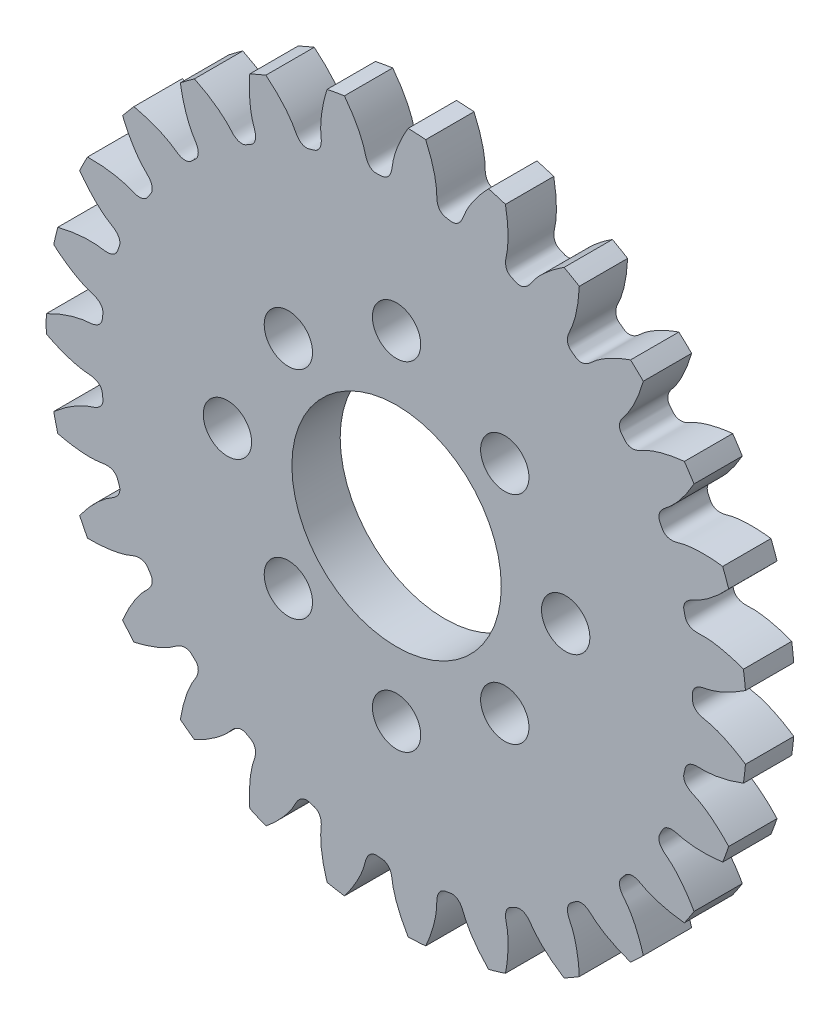
from build123d import *

# Parameters (mm, degrees)
SKETCH_327_W               = 3
SKETCH_327_H               = 21.749999673
CUT_EXTRUDE_553_DEPTH      = 9.525
PATTERN_CIRCULAR_607_COUNT = 27
SKETCH_665_W               = 19.05
SKETCH_665_H               = 6.5
CUT_EXTRUDE_1_REACH        = 32.897
SKETCH_1_R                 = 1.5


with BuildPart() as part:
    # Sketch 327 → Revolve 419 (revolve)
    with BuildSketch(Plane(origin=(0, 0, 0), x_dir=(0, 0, -1), z_dir=(1, 0, 0))):
        with Locations((0, 10.874999837)):
            Rectangle(SKETCH_327_W, SKETCH_327_H)
    revolve(axis=Axis((0, 0, 0), (0, 0, 1)))

    # Sketch 464 → Cut-Extrude 553 (cut, symmetric)
    with BuildSketch(Plane.XY):
        with BuildLine():
            ThreePointArc((21.730304777, 2.030877891), (21.824999672, 0), (21.730304777, -2.030877891))
            add(Edge.make_bspline(
                [(21.730304777, -2.030877891), (21.501886389, -1.873005257), (21.197658391, -1.679531845), (20.814976774, -1.466934394), (20.608511116, -1.359700931), (20.412627925, -1.264842331), (20.227848841, -1.181675328), (20.054665262, -1.109495914), (19.893537225, -1.047584724), (19.744895024, -0.995197179), (19.609131187, -0.951599907), (19.486623858, -0.915959224), (19.377660921, -0.887697712), (19.224611474, -0.851769328), (19.091590311, -0.832682231), (18.97946804, -0.803877533), (18.938504059, -0.792161259), (18.898408399, -0.779360789), (18.859103535, -0.765407113), (18.820505879, -0.750182868), (18.782524195, -0.733542825), (18.745062981, -0.715298046), (18.708027516, -0.695207369), (18.671333287, -0.672964742), (18.634921744, -0.648186295), (18.598785594, -0.620398387), (18.563007332, -0.589031349), (18.527814407, -0.553427143), (18.493651175, -0.512874653), (18.461259631, -0.46669073), (18.431743083, -0.414366261), (18.40657092, -0.355773095), (18.387445258, -0.291417774), (18.376745236, -0.226629052), (18.372209912, -0.128961814), (18.37704903, 0), (18.372209912, 0.128961814), (18.376745236, 0.226629052), (18.387445258, 0.291417774), (18.40657092, 0.355773095), (18.431743083, 0.414366261), (18.461259631, 0.46669073), (18.493651175, 0.512874653), (18.527814407, 0.553427143), (18.563007332, 0.589031349), (18.598785594, 0.620398387), (18.634921744, 0.648186295), (18.671333287, 0.672964742), (18.708027516, 0.695207369), (18.745062981, 0.715298046), (18.782524195, 0.733542825), (18.820505879, 0.750182868), (18.859103535, 0.765407113), (18.898408399, 0.779360789), (18.938504059, 0.792161259), (18.97946804, 0.803877533), (19.091590311, 0.832682231), (19.224611474, 0.851769328), (19.377660921, 0.887697712), (19.486623858, 0.915959224), (19.609131187, 0.951599907), (19.744895024, 0.995197179), (19.893537225, 1.047584724), (20.054665262, 1.109495914), (20.227848841, 1.181675328), (20.412627925, 1.264842331), (20.608511116, 1.359700931), (20.814976774, 1.466934394), (21.197658391, 1.679531845), (21.501886389, 1.873005257), (21.730304777, 2.030877891)],
                knots=[0, 0, 0, 0, 0.100325391, 0.13015387, 0.158174562, 0.184387468, 0.208792587, 0.231389919, 0.252179465, 0.271161225, 0.288335198, 0.303701384, 0.317259784, 0.329010398, 0.360500466, 0.365705153, 0.370832136, 0.375895619, 0.380912221, 0.385901428, 0.390886139, 0.395893275, 0.400954451, 0.406106652, 0.411392808, 0.416862069, 0.422569417, 0.428574065, 0.434935827, 0.441708513, 0.44892966, 0.456607008, 0.464704448, 0.473133083, 0.48026443, 0.5, 0.51973557, 0.526866917, 0.535295552, 0.543392992, 0.55107034, 0.558291487, 0.565064173, 0.571425935, 0.577430583, 0.583137931, 0.588607192, 0.593893348, 0.599045549, 0.604106725, 0.609113861, 0.614098572, 0.619087779, 0.624104381, 0.629167864, 0.634294847, 0.639499534, 0.670989602, 0.682740216, 0.696298616, 0.711664802, 0.728838775, 0.747820535, 0.768610081, 0.791207413, 0.815612532, 0.841825438, 0.86984613, 0.899674609, 1, 1, 1, 1], degree=3))
        make_face()
    cut_extrude_553 = extrude(amount=CUT_EXTRUDE_553_DEPTH, both=True, mode=Mode.SUBTRACT)

    # Pattern Circular 607: Cut-Extrude 553 ×27 about axis
    pattern_circular_607_axis = Axis((0, 0, 55), (0, 0, -1))
    for i in range(1, PATTERN_CIRCULAR_607_COUNT):
        add(cut_extrude_553.rotate(pattern_circular_607_axis, i * 360 / PATTERN_CIRCULAR_607_COUNT), mode=Mode.SUBTRACT)

    # Sketch 665 → Cut-Revolve 724 (revolve, cut)
    with BuildSketch(Plane(origin=(0, 0, 0), x_dir=(0, 0, -1), z_dir=(1, 0, 0))):
        with Locations((0, 3.25)):
            Rectangle(SKETCH_665_W, SKETCH_665_H)
    revolve(axis=Axis((0, 0, 0), (0, 0, -1)), mode=Mode.SUBTRACT)

    # 草图1 → 切除-拉伸1 (cut, up to next)
    with BuildSketch(Plane(origin=(0, 0, -1.5), x_dir=(-1, 0, 0), z_dir=(0, 0, -1)), mode=Mode.PRIVATE) as cut_extrude_1_sk1:
        with Locations((10.5, 0)):
            Circle(SKETCH_1_R)
    cut_extrude_1_tool1 = extrude(cut_extrude_1_sk1.sketch, amount=-CUT_EXTRUDE_1_REACH, mode=Mode.PRIVATE) & part.part
    # 草图1 → 切除-拉伸1 (cut, up to next)
    with BuildSketch(Plane(origin=(0, 0, -1.5), x_dir=(-1, 0, 0), z_dir=(0, 0, -1)), mode=Mode.PRIVATE) as cut_extrude_1_sk2:
        with Locations((-10.5, 0)):
            Circle(SKETCH_1_R)
    cut_extrude_1_tool2 = extrude(cut_extrude_1_sk2.sketch, amount=-CUT_EXTRUDE_1_REACH, mode=Mode.PRIVATE) & part.part
    # 草图1 → 切除-拉伸1 (cut, up to next)
    with BuildSketch(Plane(origin=(0, 0, -1.5), x_dir=(-1, 0, 0), z_dir=(0, 0, -1)), mode=Mode.PRIVATE) as cut_extrude_1_sk3:
        with Locations((0, 10.5)):
            Circle(SKETCH_1_R)
    cut_extrude_1_tool3 = extrude(cut_extrude_1_sk3.sketch, amount=-CUT_EXTRUDE_1_REACH, mode=Mode.PRIVATE) & part.part
    # 草图1 → 切除-拉伸1 (cut, up to next)
    with BuildSketch(Plane(origin=(0, 0, -1.5), x_dir=(-1, 0, 0), z_dir=(0, 0, -1)), mode=Mode.PRIVATE) as cut_extrude_1_sk4:
        with Locations((0, -10.5)):
            Circle(SKETCH_1_R)
    cut_extrude_1_tool4 = extrude(cut_extrude_1_sk4.sketch, amount=-CUT_EXTRUDE_1_REACH, mode=Mode.PRIVATE) & part.part
    # 草图1 → 切除-拉伸1 (cut, up to next)
    with BuildSketch(Plane(origin=(0, 0, -1.5), x_dir=(-1, 0, 0), z_dir=(0, 0, -1)), mode=Mode.PRIVATE) as cut_extrude_1_sk5:
        with Locations((-6.717514421, -6.717514421)):
            Circle(SKETCH_1_R)
    cut_extrude_1_tool5 = extrude(cut_extrude_1_sk5.sketch, amount=-CUT_EXTRUDE_1_REACH, mode=Mode.PRIVATE) & part.part
    # 草图1 → 切除-拉伸1 (cut, up to next)
    with BuildSketch(Plane(origin=(0, 0, -1.5), x_dir=(-1, 0, 0), z_dir=(0, 0, -1)), mode=Mode.PRIVATE) as cut_extrude_1_sk6:
        with Locations((-6.717514421, 6.717514421)):
            Circle(SKETCH_1_R)
    cut_extrude_1_tool6 = extrude(cut_extrude_1_sk6.sketch, amount=-CUT_EXTRUDE_1_REACH, mode=Mode.PRIVATE) & part.part
    # 草图1 → 切除-拉伸1 (cut, up to next)
    with BuildSketch(Plane(origin=(0, 0, -1.5), x_dir=(-1, 0, 0), z_dir=(0, 0, -1)), mode=Mode.PRIVATE) as cut_extrude_1_sk7:
        with Locations((6.717514421, 6.717514421)):
            Circle(SKETCH_1_R)
    cut_extrude_1_tool7 = extrude(cut_extrude_1_sk7.sketch, amount=-CUT_EXTRUDE_1_REACH, mode=Mode.PRIVATE) & part.part
    # 草图1 → 切除-拉伸1 (cut, up to next)
    with BuildSketch(Plane(origin=(0, 0, -1.5), x_dir=(-1, 0, 0), z_dir=(0, 0, -1)), mode=Mode.PRIVATE) as cut_extrude_1_sk8:
        with Locations((6.717514421, -6.717514421)):
            Circle(SKETCH_1_R)
    cut_extrude_1_tool8 = extrude(cut_extrude_1_sk8.sketch, amount=-CUT_EXTRUDE_1_REACH, mode=Mode.PRIVATE) & part.part
    add(cut_extrude_1_tool1.solids().sort_by_distance((-10.5, 0, -1.5))[0], mode=Mode.SUBTRACT)
    add(cut_extrude_1_tool2.solids().sort_by_distance((10.5, 0, -1.5))[0], mode=Mode.SUBTRACT)
    add(cut_extrude_1_tool3.solids().sort_by_distance((0, 10.5, -1.5))[0], mode=Mode.SUBTRACT)
    add(cut_extrude_1_tool4.solids().sort_by_distance((0, -10.5, -1.5))[0], mode=Mode.SUBTRACT)
    add(cut_extrude_1_tool5.solids().sort_by_distance((6.717514, -6.717514, -1.5))[0], mode=Mode.SUBTRACT)
    add(cut_extrude_1_tool6.solids().sort_by_distance((6.717514, 6.717514, -1.5))[0], mode=Mode.SUBTRACT)
    add(cut_extrude_1_tool7.solids().sort_by_distance((-6.717514, 6.717514, -1.5))[0], mode=Mode.SUBTRACT)
    add(cut_extrude_1_tool8.solids().sort_by_distance((-6.717514, -6.717514, -1.5))[0], mode=Mode.SUBTRACT)


solid = part.part
